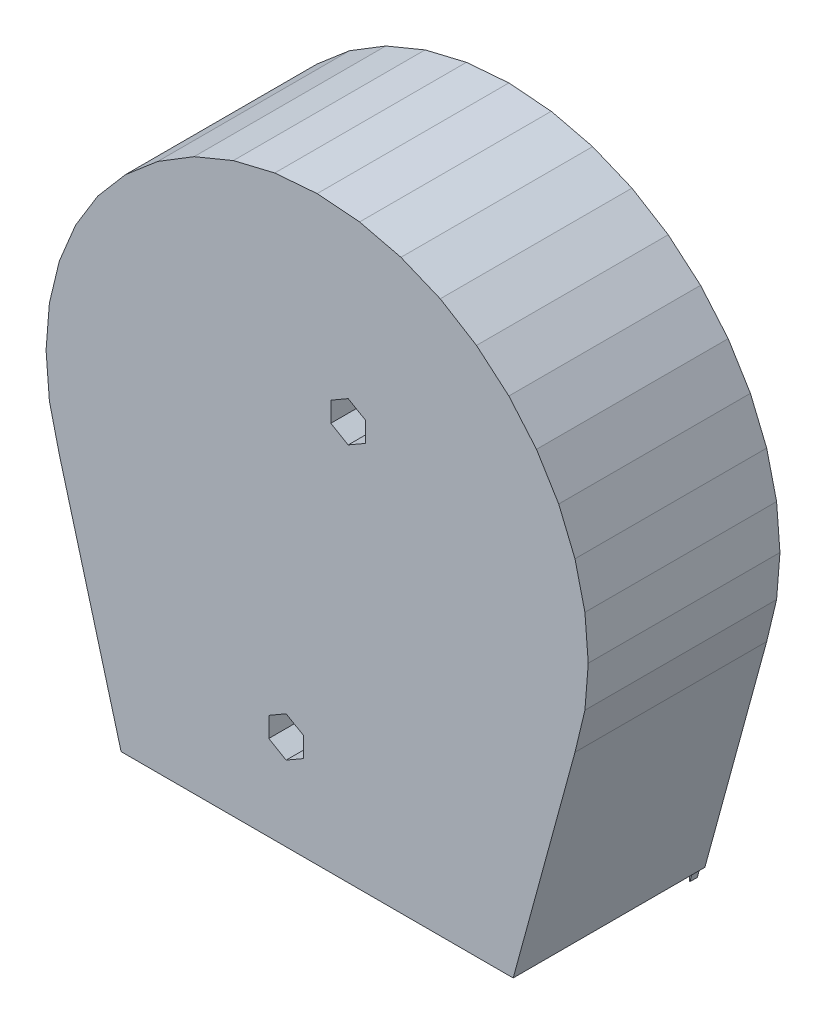
from build123d import *

# Parameters (mm, degrees)
BOSS_EXTRUDE1_START     = 22.3
BOSS_EXTRUDE1_DEPTH     = 30.9
CUT_EXTRUDE1_START      = 22.3
CUT_EXTRUDE1_DEPTH      = 29.7
BOSS_EXTRUDE2_START     = 22.3
BOSS_EXTRUDE2_DEPTH     = 1.2
CUT_EXTRUDE2_START      = 22.2
SKETCH4_W               = 50.6
SKETCH4_H               = 74.3
CUT_EXTRUDE2_DEPTH      = 1.4
CUT_EXTRUDE3_START      = 22.2
SKETCH5_W               = 60.6
SKETCH5_H               = 8.3
CUT_EXTRUDE3_DEPTH      = 1.4
BOSS_EXTRUDE3_START     = 29
SKETCH6_R               = 3.5
BOSS_EXTRUDE3_DEPTH     = 23
CUT_EXTRUDE4_DEPTH      = 87.278212777
CUT_EXTRUDE4_DEPTH_BACK = 87.278212777
SKETCH7_R               = 1.725
CUT_EXTRUDE5_START      = 47.2
CUT_EXTRUDE5_DEPTH      = 6.1


with BuildPart() as part:
    # Sketch1 → Boss-Extrude1 (new body)
    with BuildSketch(Plane.XY.offset(BOSS_EXTRUDE1_START)):
        Polygon((-43.7, 0), (-43.162, -6.8362), (-41.5612, -13.504), (-31.6, -50), (31.6, -50), (41.5612, -13.504), (43.162, -6.8362), (43.7, 0), (43.162, 6.8362), (41.5612, 13.504), (38.937, 19.8394), (35.354, 25.6862), (30.9006, 30.9006), (25.6862, 35.354), (19.8394, 38.937), (13.504, 41.5612), (6.8362, 43.162), (0, 43.7), (-6.8362, 43.162), (-13.504, 41.5612), (-19.8394, 38.937), (-25.6862, 35.354), (-30.9006, 30.9006), (-35.354, 25.6862), (-38.937, 19.8394), (-41.5612, 13.504), (-43.162, 6.8362), align=None)
    extrude(amount=BOSS_EXTRUDE1_DEPTH)

    # Sketch2 → Cut-Extrude1 (cut)
    with BuildSketch(Plane.XY.offset(CUT_EXTRUDE1_START)):
        Polygon((-42.5, 0), (-41.9768, -6.6485), (-40.4199, -13.1332), (-30.4, -52), (30.4, -52), (40.4199, -13.1332), (41.9768, -6.6485), (42.5, 0), (41.9768, 6.6485), (40.4199, 13.1332), (37.8678, 19.2946), (34.3832, 24.9809), (30.052, 30.052), (24.9809, 34.3832), (19.2946, 37.8678), (13.1332, 40.4199), (6.6485, 41.9768), (0, 42.5), (-6.6485, 41.9768), (-13.1332, 40.4199), (-19.2946, 37.8678), (-24.9809, 34.3832), (-30.052, 30.052), (-34.3832, 24.9809), (-37.8678, 19.2946), (-40.4199, 13.1332), (-41.9768, 6.6485), align=None)
    extrude(amount=CUT_EXTRUDE1_DEPTH, mode=Mode.SUBTRACT)

    # Sketch3 → Boss-Extrude2 (add)
    with BuildSketch(Plane.XY.offset(BOSS_EXTRUDE2_START)):
        Polygon((-42.5, 0), (-41.9768, -6.6485), (-40.4199, -13.1332), (-30.4, -52), (30.4, -52), (40.4199, -13.1332), (41.9768, -6.6485), (42.5, 0), (41.9768, 6.6485), (40.4199, 13.1332), (37.8678, 19.2946), (34.3832, 24.9809), (30.052, 30.052), (24.9809, 34.3832), (19.2946, 37.8678), (13.1332, 40.4199), (6.6485, 41.9768), (0, 42.5), (-6.6485, 41.9768), (-13.1332, 40.4199), (-19.2946, 37.8678), (-24.9809, 34.3832), (-30.052, 30.052), (-34.3832, 24.9809), (-37.8678, 19.2946), (-40.4199, 13.1332), (-41.9768, 6.6485), align=None)
    extrude(amount=BOSS_EXTRUDE2_DEPTH)

    # Sketch4 → Cut-Extrude2 (cut)
    with BuildSketch(Plane.XY.offset(CUT_EXTRUDE2_START)):
        with Locations((0, -15.85)):
            Rectangle(SKETCH4_W, SKETCH4_H)
    extrude(amount=CUT_EXTRUDE2_DEPTH, mode=Mode.SUBTRACT)

    # Sketch5 → Cut-Extrude3 (cut)
    with BuildSketch(Plane.XY.offset(CUT_EXTRUDE3_START)):
        with Locations((0, -48.85)):
            Rectangle(SKETCH5_W, SKETCH5_H)
    extrude(amount=CUT_EXTRUDE3_DEPTH, mode=Mode.SUBTRACT)

    # Sketch6 → Boss-Extrude3 (add)
    with BuildSketch(Plane.XY.offset(BOSS_EXTRUDE3_START)):
        with Locations((5, 14.35)):
            Circle(SKETCH6_R)
        with Locations((-5, -34.65)):
            Circle(SKETCH6_R)
    extrude(amount=BOSS_EXTRUDE3_DEPTH)

    # Sketch7 → Cut-Extrude4 (cut, two sides: drawn at the far end of the back side and taken through both)
    with BuildSketch(Plane.XY.offset(-CUT_EXTRUDE4_DEPTH_BACK)):
        with Locations((5, 14.35)):
            Circle(SKETCH7_R)
        with Locations((-5, -34.65)):
            Circle(SKETCH7_R)
    extrude(amount=CUT_EXTRUDE4_DEPTH + CUT_EXTRUDE4_DEPTH_BACK, mode=Mode.SUBTRACT)

    # Sketch8 → Cut-Extrude5 (cut)
    with BuildSketch(Plane.XY.offset(CUT_EXTRUDE5_START)):
        Polygon((7.8, 15.966580754), (5, 17.583161507), (2.2, 15.966580754), (2.2, 12.733419246), (5, 11.116838493), (7.8, 12.733419246), align=None)
        Polygon((-2.2, -33.033419246), (-5, -31.416838493), (-7.8, -33.033419246), (-7.8, -36.266580754), (-5, -37.883161507), (-2.2, -36.266580754), align=None)
    extrude(amount=CUT_EXTRUDE5_DEPTH, mode=Mode.SUBTRACT)


solid = part.part
